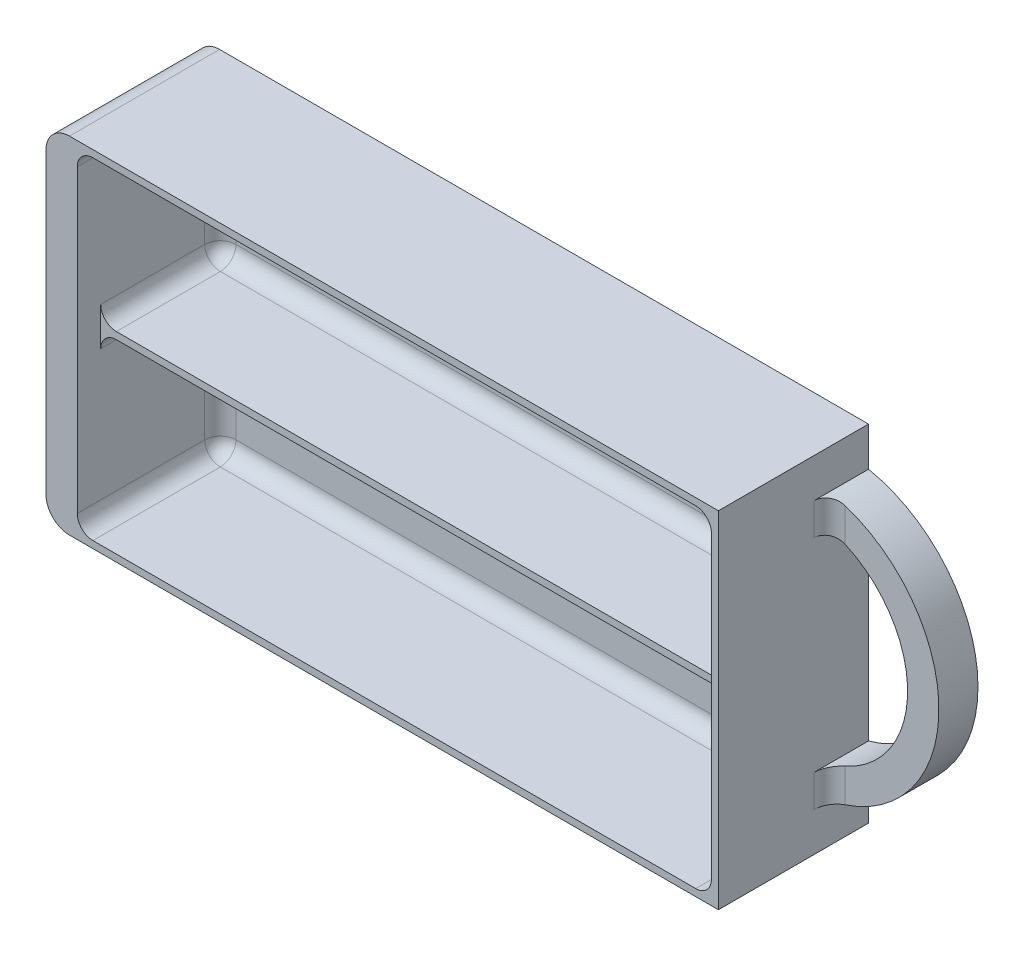
from build123d import *

# Parameters (mm, degrees)
SKETCH_1_W                  = 86
SKETCH_1_H                  = 44.2
EXTRUDE_1_DEPTH             = 14.2
EXTRUDE_2_DEPTH             = 5
SKETCH_3_W                  = 81.1
SKETCH_3_H                  = 42.4
CUT_EXTRUDE_1_DEPTH         = 18.3
HOLE_WIZARD_8_3_8_3_1_D     = 8.3
HOLE_WIZARD_8_3_8_3_1_DEPTH = 3.2
RIB_1_REACH                 = 108.755
SKETCH_6_WALL_W             = 296.60943773
SKETCH_6_WALL_H             = 0.9
FILLET_1_R                  = 3
EXTRUDE_START               = -3.5
SKETCH_7_R                  = 4.15
EXTRUDE_3_DEPTH             = 3.5
FILLET_2_R                  = 2


with BuildPart() as part:
    # Эскиз1 → Бобышка-Вытянуть1 (new body)
    with BuildSketch(Plane.XY.offset(9.6)):
        with Locations((47, 0)):
            Rectangle(SKETCH_1_W, SKETCH_1_H)
    extrude(amount=-EXTRUDE_1_DEPTH)

    # Эскиз2 → Бобышка-Вытянуть2 (add)
    with BuildSketch(Plane(origin=(0, 0, -4.6), x_dir=(-1, 0, 0), z_dir=(0, 0, -1))):
        with BuildLine():
            Line((-90, -22.1), (-90, -17.1))
            ThreePointArc((-90, -17.1), (-104, 0), (-90, 17.1))
            Line((-90, 17.1), (-90, 22.1))
            Line((-90, 22.1), (-4, 22.1))
            Line((-4, 22.1), (-4, -22.1))
            Line((-4, -22.1), (-90, -22.1))
        make_face()
        with BuildLine():
            Line((-90, -12.994779171), (-90, 12.994779171))
            ThreePointArc((-90, 12.994779171), (-100, 0), (-90, -12.994779171))
        make_face(mode=Mode.SUBTRACT)
    extrude(amount=EXTRUDE_2_DEPTH)

    # Эскиз3 → Вырез-Вытянуть1 (cut)
    with BuildSketch(Plane.XY.offset(9.6)):
        with Locations((48.55, 0)):
            Rectangle(SKETCH_3_W, SKETCH_3_H)
    extrude(amount=-CUT_EXTRUDE_1_DEPTH, mode=Mode.SUBTRACT)

    # Диаметр отверстия Ø8.3 (8.3)1
    with Locations(Plane.ZY.offset(-4)):
        with Locations((0, 0)):
            Hole(HOLE_WIZARD_8_3_8_3_1_D / 2, depth=HOLE_WIZARD_8_3_8_3_1_DEPTH)

    # Эскиз6 wall → Ребро1 (add, up to next)
    with BuildSketch(Plane(origin=(48.55, 0, 6.6), x_dir=(1, 0, 0), z_dir=(0, 0, -1)), mode=Mode.PRIVATE) as rib_1_sk1:
        Rectangle(SKETCH_6_WALL_W, SKETCH_6_WALL_H)
    rib_1_tool1 = extrude(rib_1_sk1.sketch, amount=RIB_1_REACH, mode=Mode.PRIVATE) - part.part
    add(rib_1_tool1.solids().sort_by_distance((48.55, 0, 6.6))[0])

    # Скругление1
    fillet_1_edges = [part.edges().sort_by_distance(p)[0] for p in [
        (4, -22.1, 0),
        (4, 22.1, 0),
    ]]
    fillet(fillet_1_edges, radius=FILLET_1_R)

    # Эскиз7 → Бобышка-Вытянуть3 (add)
    with BuildSketch(Plane.ZY.offset(-4).offset(EXTRUDE_START)):
        Circle(SKETCH_7_R)
    extrude(amount=EXTRUDE_3_DEPTH)

    # Скругление2
    fillet_2_edges = [part.edges().sort_by_distance(p)[0] for p in [
        (90, -15.047389586, -4.6),
        (90, 15.047389586, -4.6),
        (8, 10.825, -8.7),
        (8, -21.2, 0.45),
        (48.55, 21.2, -8.7),
        (8, 21.2, 0.45),
        (89.1, -10.825, -8.7),
        (89.1, 21.2, 0.45),
        (48.55, -21.2, -8.7),
        (89.1, -21.2, 0.45),
        (8, -10.825, -8.7),
        (89.1, 10.825, -8.7),
        (48.55, 0.45, -8.7),
        (8, 0.45, -1.05),
        (89.1, 0.45, -1.05),
        (8, -0.45, -1.05),
        (89.1, -0.45, -1.05),
        (48.55, -0.45, -8.7),
    ]]
    fillet(fillet_2_edges, radius=FILLET_2_R)


solid = part.part
